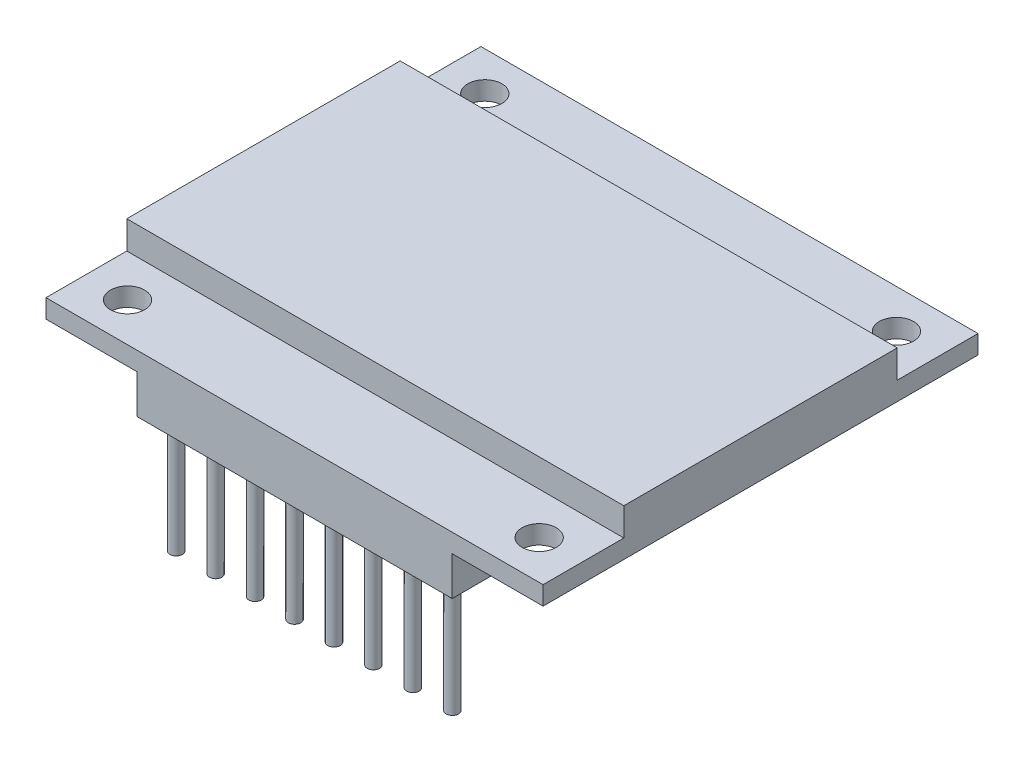
from build123d import *

# Parameters (mm, degrees)
SKETCH_1_W          = 32
SKETCH_1_H          = 28
EXTRUDE_1_DEPTH     = 1.2
SKETCH_2_W          = 32
SKETCH_2_H          = 17.6
EXTRUDE_2_DEPTH     = 1.8
SKETCH_3_R          = 1.1
CUT_EXTRUDE_1_DEPTH = 43.558665393
SKETCH_4_R          = 0.4
EXTRUDE_3_DEPTH     = 10
SKETCH_5_W          = 20.3
SKETCH_5_H          = 2.5
EXTRUDE_4_DEPTH     = 2.5


with BuildPart() as part:
    # 草图1 → 凸台-拉伸1 (new body)
    with BuildSketch(Plane(origin=(0, 0, 0), x_dir=(1, 0, 0), z_dir=(0, 1, 0))):
        with Locations((16, 14)):
            Rectangle(SKETCH_1_W, SKETCH_1_H)
    extrude(amount=EXTRUDE_1_DEPTH)

    # 草图2 → 凸台-拉伸2 (add)
    with BuildSketch(Plane(origin=(0, 1.2, 0), x_dir=(1, 0, 0), z_dir=(0, 1, 0))):
        with Locations((16, 14)):
            Rectangle(SKETCH_2_W, SKETCH_2_H)
    extrude(amount=EXTRUDE_2_DEPTH)

    # 草图3 → 切除-拉伸1 (cut, through all)
    with BuildSketch(Plane(origin=(0, 1.2, 0), x_dir=(1, 0, 0), z_dir=(0, 1, 0))):
        with Locations(Location((2.75, 25.5, 0), (0, 0, 270))):
            Circle(SKETCH_3_R)
        with Locations(Location((2.75, 2.5, 0), (0, 0, 90))):
            Circle(SKETCH_3_R)
        with Locations(Location((29.25, 2.5, 0), (0, 0, 270))):
            Circle(SKETCH_3_R)
        with Locations(Location((29.25, 25.5, 0), (0, 0, 90))):
            Circle(SKETCH_3_R)
    extrude(amount=-CUT_EXTRUDE_1_DEPTH, mode=Mode.SUBTRACT)

    # 草图4 → 凸台-拉伸3 (add)
    with BuildSketch(Plane.XZ):
        with Locations(Location((7.11, -1.27, 0), (0, 0, 270))):
            Circle(SKETCH_4_R)
        with Locations(Location((9.65, -1.27, 0), (0, 0, 270))):
            Circle(SKETCH_4_R)
        with Locations(Location((12.19, -1.27, 0), (0, 0, 270))):
            Circle(SKETCH_4_R)
        with Locations(Location((14.73, -1.27, 0), (0, 0, 270))):
            Circle(SKETCH_4_R)
        with Locations(Location((17.27, -1.27, 0), (0, 0, 270))):
            Circle(SKETCH_4_R)
        with Locations(Location((19.81, -1.27, 0), (0, 0, 270))):
            Circle(SKETCH_4_R)
        with Locations(Location((22.35, -1.27, 0), (0, 0, 270))):
            Circle(SKETCH_4_R)
        with Locations(Location((24.89, -1.27, 0), (0, 0, 270))):
            Circle(SKETCH_4_R)
    extrude(amount=EXTRUDE_3_DEPTH)

    # 草图5 → 凸台-拉伸4 (add)
    with BuildSketch(Plane.XZ):
        with Locations((16, -1.25)):
            Rectangle(SKETCH_5_W, SKETCH_5_H)
    extrude(amount=EXTRUDE_4_DEPTH)


solid = part.part
